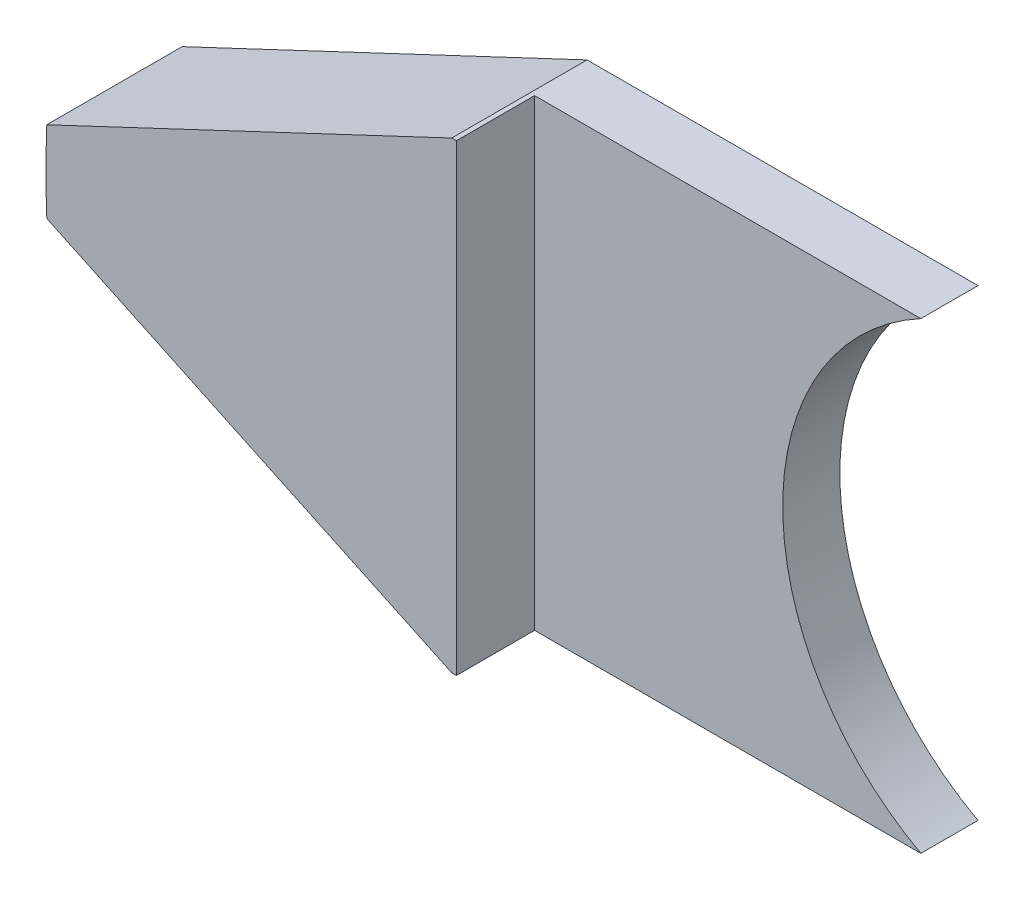
from build123d import *

# Parameters (mm, degrees)
EXTRUDE_1_DEPTH     = 7
CUT_EXTRUDE_START   = -5.1
CUT_EXTRUDE_1_DEPTH = 5.1
CUT_EXTRUDE_START_2 = -2.5
CUT_EXTRUDE_2_DEPTH = 2.5


with BuildPart() as part:
    # Эскиз1 → Бобышка-Вытянуть1 (new body)
    with BuildSketch(Plane.XY):
        with BuildLine():
            Line((-17.15601973, -7.7), (-30.620254734, -1.35))
            ThreePointArc((-30.620254734, -1.35), (-30.65, 0), (-30.620254734, 1.35))
            Line((-30.620254734, 1.35), (-17.15601973, 7.7))
            Line((-17.15601973, 7.7), (-4.15601973, 7.7))
            ThreePointArc((-4.15601973, 7.7), (-8.75, 0), (-4.15601973, -7.7))
            Line((-4.15601973, -7.7), (-17.15601973, -7.7))
        make_face()
    extrude(amount=EXTRUDE_1_DEPTH)

    # Эскиз2 → Вырез-Вытянуть1 (cut)
    with BuildSketch(Plane.XY.offset(7).offset(CUT_EXTRUDE_START)):
        with BuildLine():
            Line((-4.15601973, 7.7), (-17, 7.7))
            Line((-17, 7.7), (-17, -7.7))
            Line((-17, -7.7), (-4.15601973, -7.7))
            ThreePointArc((-4.15601973, -7.7), (-8.75, 0), (-4.15601973, 7.7))
        make_face()
    extrude(amount=CUT_EXTRUDE_1_DEPTH, mode=Mode.SUBTRACT)

    # Эскиз2<5> → Вырез-Вытянуть2 (cut)
    with BuildSketch(Plane.XY.offset(7).offset(CUT_EXTRUDE_START_2)):
        with BuildLine():
            Line((-17, -7.7), (-17, 7.7))
            Line((-17, 7.7), (-17.15601973, 7.7))
            Line((-17.15601973, 7.7), (-30.620254734, 1.35))
            ThreePointArc((-30.620254734, 1.35), (-30.65, 0), (-30.620254734, -1.35))
            Line((-30.620254734, -1.35), (-17.15601973, -7.7))
            Line((-17.15601973, -7.7), (-17, -7.7))
        make_face()
    extrude(amount=CUT_EXTRUDE_2_DEPTH, mode=Mode.SUBTRACT)


solid = part.part
